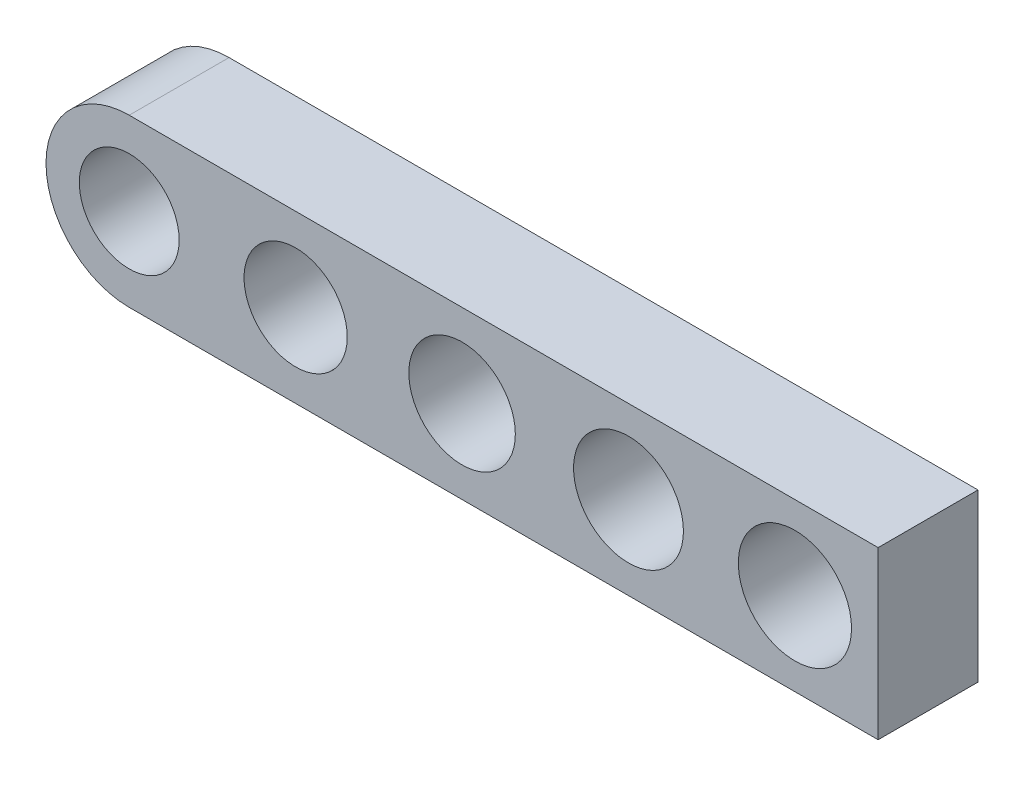
from build123d import *

# Parameters (mm, degrees)
SKETCH_1_R      = 1.5
SKETCH_1_R_2    = 1.55
SKETCH_1_R_3    = 1.6
SKETCH_1_R_4    = 1.65
SKETCH_1_R_5    = 1.7
EXTRUDE_1_DEPTH = 3


with BuildPart() as part:
    # 草图1 → 凸台-拉伸1 (new body)
    with BuildSketch(Plane.XY):
        with BuildLine():
            Line((0, 2.5), (17.5, 2.5))
            Line((17.5, 2.5), (22.5, 2.5))
            Line((22.5, 2.5), (22.5, -2.5))
            Line((22.5, -2.5), (17.5, -2.5))
            Line((17.5, -2.5), (0, -2.5))
            ThreePointArc((0, -2.5), (-2.5, 0), (0, 2.5))
        make_face()
        Circle(SKETCH_1_R, mode=Mode.SUBTRACT)
        with Locations((5, 0)):
            Circle(SKETCH_1_R_2, mode=Mode.SUBTRACT)
        with Locations((10, 0)):
            Circle(SKETCH_1_R_3, mode=Mode.SUBTRACT)
        with Locations((15, 0)):
            Circle(SKETCH_1_R_4, mode=Mode.SUBTRACT)
        with Locations((20, 0)):
            Circle(SKETCH_1_R_5, mode=Mode.SUBTRACT)
    extrude(amount=EXTRUDE_1_DEPTH)


solid = part.part
